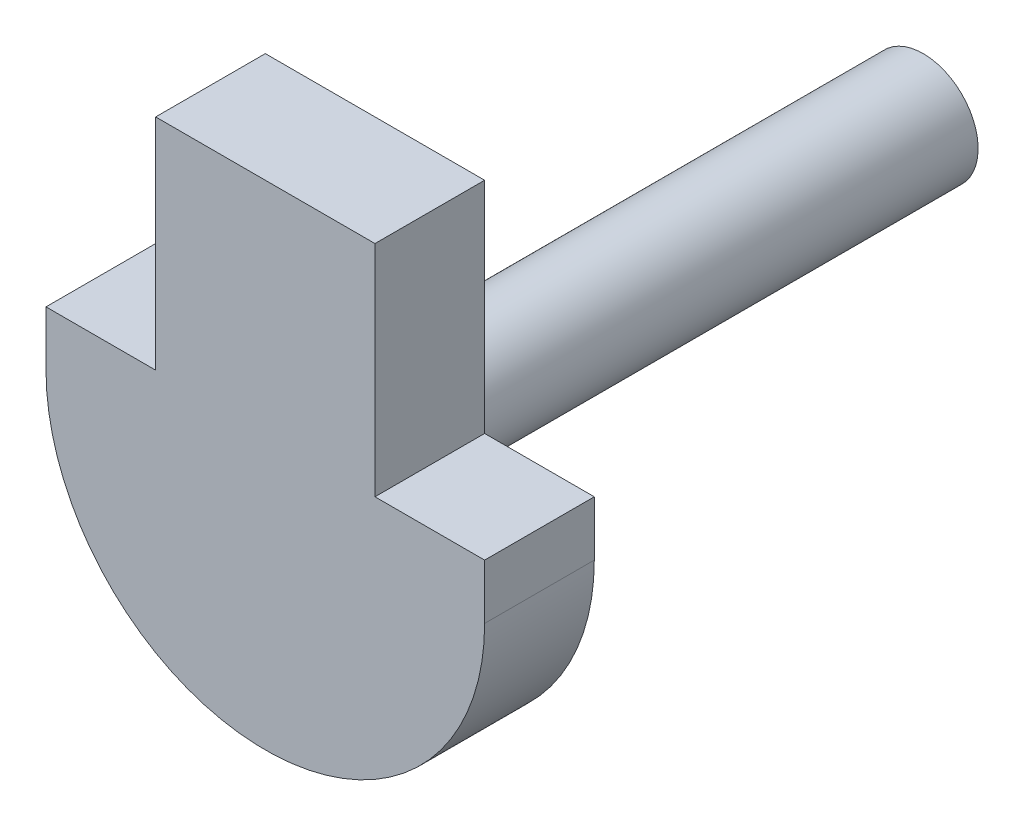
from build123d import *

# Parameters (mm, degrees)
BOSS_EXTRU_1_DEPTH = 10
ESQUISSE2_R        = 5
BOSS_EXTRU_2_DEPTH = 50


with BuildPart() as part:
    # Esquisse1 → Boss.-Extru.1 (new body)
    with BuildSketch(Plane.XY):
        with BuildLine():
            Line((-20, 0), (-20, 5))
            Line((-20, 5), (-10, 5))
            Line((-10, 5), (-10, 25))
            Line((-10, 25), (10, 25))
            Line((10, 25), (10, 5))
            Line((10, 5), (20, 5))
            Line((20, 5), (20, 0))
            ThreePointArc((20, 0), (0, -20), (-20, 0))
        make_face()
    extrude(amount=BOSS_EXTRU_1_DEPTH)

    # Esquisse2 → Boss.-Extru.2 (add)
    with BuildSketch(Plane(origin=(0, 0, 0), x_dir=(-1, 0, 0), z_dir=(0, 0, -1))):
        Circle(ESQUISSE2_R)
    extrude(amount=BOSS_EXTRU_2_DEPTH)


solid = part.part
